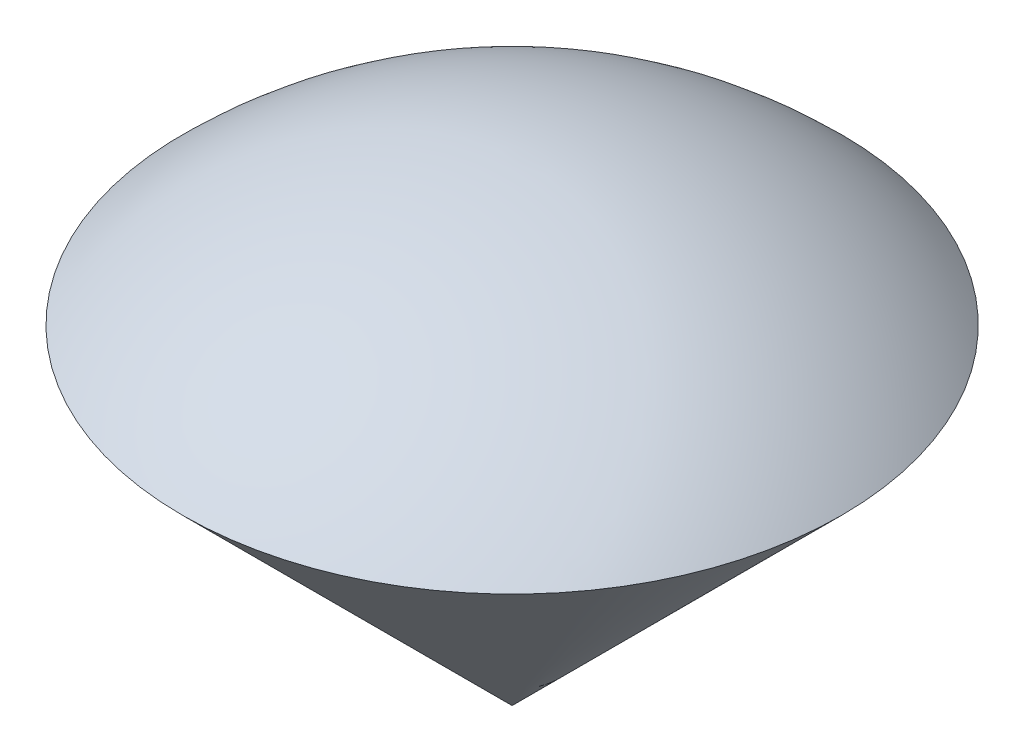
from build123d import *


with BuildPart() as part:
    # Sketch1 → Revolve1 (revolve)
    with BuildSketch(Plane.XY, mode=Mode.PRIVATE) as revolve1_sk:
        with BuildLine():
            Line((3.535533906, 3.535533906), (0, 0))
            Line((0, 0), (0, 5))
            ThreePointArc((0, 5), (1.913417162, 4.619397663), (3.535533906, 3.535533906))
        make_face()
    revolve(revolve1_sk.sketch.rotate(Axis((0, 0, 0), (0, 1, 0)), 270), axis=Axis((0, 0, 0), (0, 1, 0)))


solid = part.part
